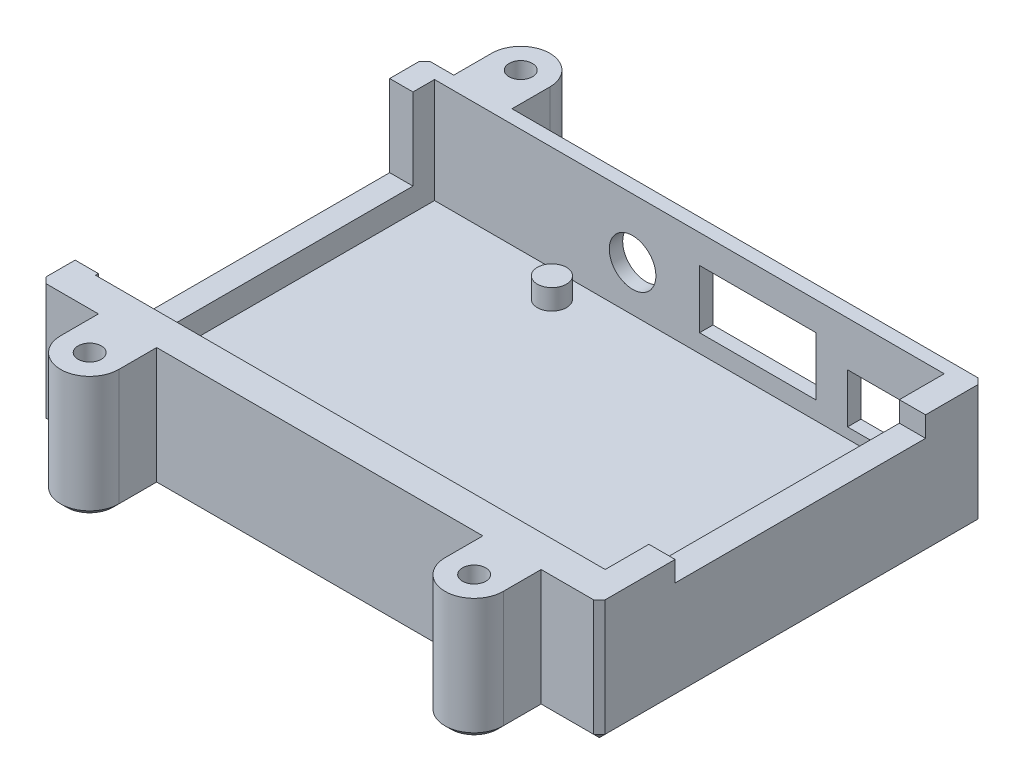
from build123d import *

# Parameters (mm, degrees)
SKETCH1_W           = 96
SKETCH1_H           = 66
BOSS_EXTRUDE2_DEPTH = 3
SKETCH4_R           = 2
BOSS_EXTRUDE3_DEPTH = 3
SKETCH8_R           = 2.5
BOSS_EXTRUDE5_DEPTH = 3.5
SKETCH9_W           = 96
SKETCH9_H           = 66
SKETCH9_W_2         = 87.5
SKETCH9_H_2         = 58.2
BOSS_EXTRUDE6_DEPTH = 18
SKETCH11_W          = 54
SKETCH11_H          = 14
CUT_EXTRUDE1_DEPTH  = 4
SKETCH12_W          = 43
SKETCH12_H          = 3.5
CUT_EXTRUDE2_DEPTH  = 4.5
SKETCH13_W          = 16
SKETCH13_H          = 5
CUT_EXTRUDE3_DEPTH  = 3.5
SKETCH14_R          = 4
SKETCH14_W          = 12
SKETCH14_H          = 8.5
SKETCH14_W_2        = 20
SKETCH14_H_2        = 10
CUT_EXTRUDE4_DEPTH  = 2.3
SKETCH16_R          = 2
BOSS_EXTRUDE7_DEPTH = 18
CHAMFER2_SIZE       = 1


with BuildPart() as part:
    # Sketch1 → Boss-Extrude2 (new body)
    with BuildSketch(Plane(origin=(0, 0, 0), x_dir=(1, 0, 0), z_dir=(0, 1, 0))):
        Rectangle(SKETCH1_W, SKETCH1_H)
    extrude(amount=BOSS_EXTRUDE2_DEPTH)

    # Sketch4 → Boss-Extrude3 (add)
    # profile 1 of 3: a face of its own
    with BuildSketch(Plane(origin=(0, 0, 0), x_dir=(1, 0, 0), z_dir=(0, 1, 0))):
        with BuildLine():
            Line((-43, 33), (-43, 39.5))
            ThreePointArc((-43, 39.5), (-38, 44.5), (-33, 39.5))
            Line((-33, 39.5), (-33, 33))
            ThreePointArc((-33, 33), (-38, 28), (-43, 33))
        make_face()
        with Locations(Location((-38, 39.5, 0), (0, 0, 270))):
            Circle(SKETCH4_R, mode=Mode.SUBTRACT)
    # profile 2 of 3: a face of its own
    with BuildSketch(Plane(origin=(0, 0, 0), x_dir=(1, 0, 0), z_dir=(0, 1, 0))):
        with BuildLine():
            Line((-28, -33), (-28, -39.5))
            ThreePointArc((-28, -39.5), (-33, -44.5), (-38, -39.5))
            Line((-38, -39.5), (-38, -33))
            ThreePointArc((-38, -33), (-33, -28), (-28, -33))
        make_face()
        with Locations(Location((-33, -39.5, 0), (0, 0, 270))):
            Circle(SKETCH4_R, mode=Mode.SUBTRACT)
    # profile 3 of 3: a face of its own
    with BuildSketch(Plane(origin=(0, 0, 0), x_dir=(1, 0, 0), z_dir=(0, 1, 0))):
        with BuildLine():
            Line((38, -33), (38, -39.5))
            ThreePointArc((38, -39.5), (33, -44.5), (28, -39.5))
            Line((28, -39.5), (28, -33))
            ThreePointArc((28, -33), (33, -28), (38, -33))
        make_face()
        with Locations(Location((33, -39.5, 0), (0, 0, 270))):
            Circle(SKETCH4_R, mode=Mode.SUBTRACT)
    extrude(amount=BOSS_EXTRUDE3_DEPTH)

    # Sketch8 → Boss-Extrude5 (add)
    with BuildSketch(Plane(origin=(0, 3, 0), x_dir=(1, 0, 0), z_dir=(0, 1, 0))):
        with Locations(Location((-19.25, 26.1, 0), (0, 0, 270))):
            Circle(SKETCH8_R)
        with Locations(Location((38.75, 26.1, 0), (0, 0, 270))):
            Circle(SKETCH8_R)
        with Locations(Location((38.75, -22.9, 0), (0, 0, 270))):
            Circle(SKETCH8_R)
        with Locations(Location((-19.25, -22.9, 0), (0, 0, 270))):
            Circle(SKETCH8_R)
    extrude(amount=BOSS_EXTRUDE5_DEPTH)

    # Sketch9 → Boss-Extrude6 (add)
    with BuildSketch(Plane(origin=(0, 3, 0), x_dir=(1, 0, 0), z_dir=(0, 1, 0))):
        Rectangle(SKETCH9_W, SKETCH9_H)
        with Locations((-0.25, 1.6)):
            Rectangle(SKETCH9_W_2, SKETCH9_H_2, mode=Mode.SUBTRACT)
    extrude(amount=BOSS_EXTRUDE6_DEPTH)

    # Sketch11 → Cut-Extrude1 (cut)
    with BuildSketch(Plane.ZY.offset(48)):
        with Locations((0, 14)):
            Rectangle(SKETCH11_W, SKETCH11_H)
    extrude(amount=-CUT_EXTRUDE1_DEPTH, mode=Mode.SUBTRACT)

    # Sketch12 → Cut-Extrude2 (cut)
    with BuildSketch(Plane(origin=(48, 0, 0), x_dir=(0, 0, -1), z_dir=(1, 0, 0))):
        with Locations((1.5, 19.25)):
            Rectangle(SKETCH12_W, SKETCH12_H)
    extrude(amount=-CUT_EXTRUDE2_DEPTH, mode=Mode.SUBTRACT)

    # Sketch13 → Cut-Extrude3 (cut)
    with BuildSketch(Plane.ZY.offset(-43.5)):
        with Locations((-1.07504867, 5.5)):
            Rectangle(SKETCH13_W, SKETCH13_H)
    extrude(amount=-CUT_EXTRUDE3_DEPTH, mode=Mode.SUBTRACT)

    # Sketch14 → Cut-Extrude4 (cut)
    with BuildSketch(Plane(origin=(0, 0, -33), x_dir=(-1, 0, 0), z_dir=(0, 0, -1))):
        with Locations((10, 10.8)):
            Circle(SKETCH14_R)
        with Locations((-32.9, 9.05)):
            Rectangle(SKETCH14_W, SKETCH14_H)
        with Locations((-11.5, 11.1)):
            Rectangle(SKETCH14_W_2, SKETCH14_H_2)
    extrude(amount=-CUT_EXTRUDE4_DEPTH, mode=Mode.SUBTRACT)

    # Sketch16 → Boss-Extrude7 (add)
    # profile 1 of 3: a face of its own
    with BuildSketch(Plane(origin=(0, 3, 0), x_dir=(1, 0, 0), z_dir=(0, 1, 0))):
        with BuildLine():
            Line((-43, 33), (-33, 33))
            Line((-33, 33), (-33, 39.5))
            ThreePointArc((-33, 39.5), (-38, 44.5), (-43, 39.5))
            Line((-43, 39.5), (-43, 33))
        make_face()
        with Locations(Location((-38, 39.5, 0), (0, 0, 90))):
            Circle(SKETCH16_R, mode=Mode.SUBTRACT)
    # profile 2 of 3: a face of its own
    with BuildSketch(Plane(origin=(0, 3, 0), x_dir=(1, 0, 0), z_dir=(0, 1, 0))):
        with BuildLine():
            Line((-38, -33), (-38, -39.5))
            ThreePointArc((-38, -39.5), (-33, -44.5), (-28, -39.5))
            Line((-28, -39.5), (-28, -33))
            Line((-28, -33), (-38, -33))
        make_face()
        with Locations(Location((-33, -39.5, 0), (0, 0, 90))):
            Circle(SKETCH16_R, mode=Mode.SUBTRACT)
    # profile 3 of 3: a face of its own
    with BuildSketch(Plane(origin=(0, 3, 0), x_dir=(1, 0, 0), z_dir=(0, 1, 0))):
        with BuildLine():
            Line((28, -39.5), (28, -33))
            Line((28, -33), (38, -33))
            Line((38, -33), (38, -39.5))
            ThreePointArc((38, -39.5), (33, -44.5), (28, -39.5))
        make_face()
        with Locations(Location((33, -39.5, 0), (0, 0, 90))):
            Circle(SKETCH16_R, mode=Mode.SUBTRACT)
    extrude(amount=BOSS_EXTRUDE7_DEPTH)

    # Chamfer2
    chamfer2_edges = [part.edges().sort_by_distance(p)[0] for p in [
        (-45.5, 0, -33),
        (-33, 0, -36.25),
        (-38, 0, -44.5),
        (-43, 0, -36.25),
        (-43, 0, 33),
        (-38, 0, 36.25),
        (-33, 0, 44.5),
        (-28, 0, 36.25),
        (0, 0, 33),
        (48, 0, 0),
        (28, 0, 36.25),
        (33, 0, 44.5),
        (38, 0, 36.25),
        (43, 0, 33),
        (-48, 0, 0),
        (7.5, 0, -33),
        (48, 10.5, -33),
        (48, 10.5, 33),
        (-48, 10.5, 33),
        (-48, 10.5, -33),
    ]]
    chamfer(chamfer2_edges, length=CHAMFER2_SIZE)


solid = part.part
